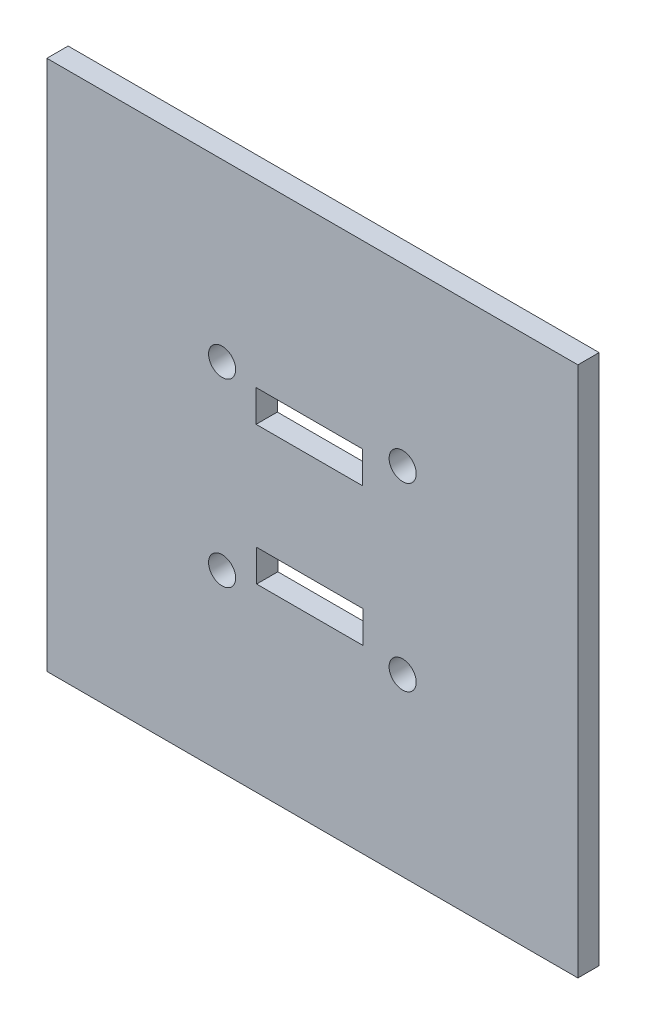
from build123d import *

# Parameters (mm, degrees)
SKETCH1_W           = 50
SKETCH1_H           = 50
BOSS_EXTRUDE1_DEPTH = 2
CUT_EXTRUDE1_REACH  = 72.739
SKETCH3_R           = 1.275
CUT_EXTRUDE2_REACH  = 72.739
SKETCH4_W           = 10
SKETCH4_H           = 3


with BuildPart() as part:
    # Sketch1 → Boss-Extrude1 (new body)
    with BuildSketch(Plane.XY):
        with Locations((25, 25)):
            Rectangle(SKETCH1_W, SKETCH1_H)
    extrude(amount=BOSS_EXTRUDE1_DEPTH)

    # Sketch3 → Cut-Extrude1 (cut, up to next)
    with BuildSketch(Plane.XY.offset(2), mode=Mode.PRIVATE) as cut_extrude1_sk1:
        with Locations((16.5, 33.5)):
            Circle(SKETCH3_R)
    cut_extrude1_tool1 = extrude(cut_extrude1_sk1.sketch, amount=-CUT_EXTRUDE1_REACH, mode=Mode.PRIVATE) & part.part
    # Sketch3 → Cut-Extrude1 (cut, up to next)
    with BuildSketch(Plane.XY.offset(2), mode=Mode.PRIVATE) as cut_extrude1_sk2:
        with Locations((33.5, 33.5)):
            Circle(SKETCH3_R)
    cut_extrude1_tool2 = extrude(cut_extrude1_sk2.sketch, amount=-CUT_EXTRUDE1_REACH, mode=Mode.PRIVATE) & part.part
    # Sketch3 → Cut-Extrude1 (cut, up to next)
    with BuildSketch(Plane.XY.offset(2), mode=Mode.PRIVATE) as cut_extrude1_sk3:
        with Locations((33.5, 16.5)):
            Circle(SKETCH3_R)
    cut_extrude1_tool3 = extrude(cut_extrude1_sk3.sketch, amount=-CUT_EXTRUDE1_REACH, mode=Mode.PRIVATE) & part.part
    # Sketch3 → Cut-Extrude1 (cut, up to next)
    with BuildSketch(Plane.XY.offset(2), mode=Mode.PRIVATE) as cut_extrude1_sk4:
        with Locations((16.5, 16.5)):
            Circle(SKETCH3_R)
    cut_extrude1_tool4 = extrude(cut_extrude1_sk4.sketch, amount=-CUT_EXTRUDE1_REACH, mode=Mode.PRIVATE) & part.part
    add(cut_extrude1_tool1.solids().sort_by_distance((16.5, 33.5, 2))[0], mode=Mode.SUBTRACT)
    add(cut_extrude1_tool2.solids().sort_by_distance((33.5, 33.5, 2))[0], mode=Mode.SUBTRACT)
    add(cut_extrude1_tool3.solids().sort_by_distance((33.5, 16.5, 2))[0], mode=Mode.SUBTRACT)
    add(cut_extrude1_tool4.solids().sort_by_distance((16.5, 16.5, 2))[0], mode=Mode.SUBTRACT)

    # Sketch4 → Cut-Extrude2 (cut, up to next)
    with BuildSketch(Plane.XY.offset(2), mode=Mode.PRIVATE) as cut_extrude2_sk1:
        with Locations((24.7, 31.5)):
            Rectangle(SKETCH4_W, SKETCH4_H)
    cut_extrude2_tool1 = extrude(cut_extrude2_sk1.sketch, amount=-CUT_EXTRUDE2_REACH, mode=Mode.PRIVATE) & part.part
    # Sketch4 → Cut-Extrude2 (cut, up to next)
    with BuildSketch(Plane.XY.offset(2), mode=Mode.PRIVATE) as cut_extrude2_sk2:
        with Locations((24.75, 18.5)):
            Rectangle(SKETCH4_W, SKETCH4_H)
    cut_extrude2_tool2 = extrude(cut_extrude2_sk2.sketch, amount=-CUT_EXTRUDE2_REACH, mode=Mode.PRIVATE) & part.part
    add(cut_extrude2_tool1.solids().sort_by_distance((24.7, 31.5, 2))[0], mode=Mode.SUBTRACT)
    add(cut_extrude2_tool2.solids().sort_by_distance((24.75, 18.5, 2))[0], mode=Mode.SUBTRACT)


solid = part.part
